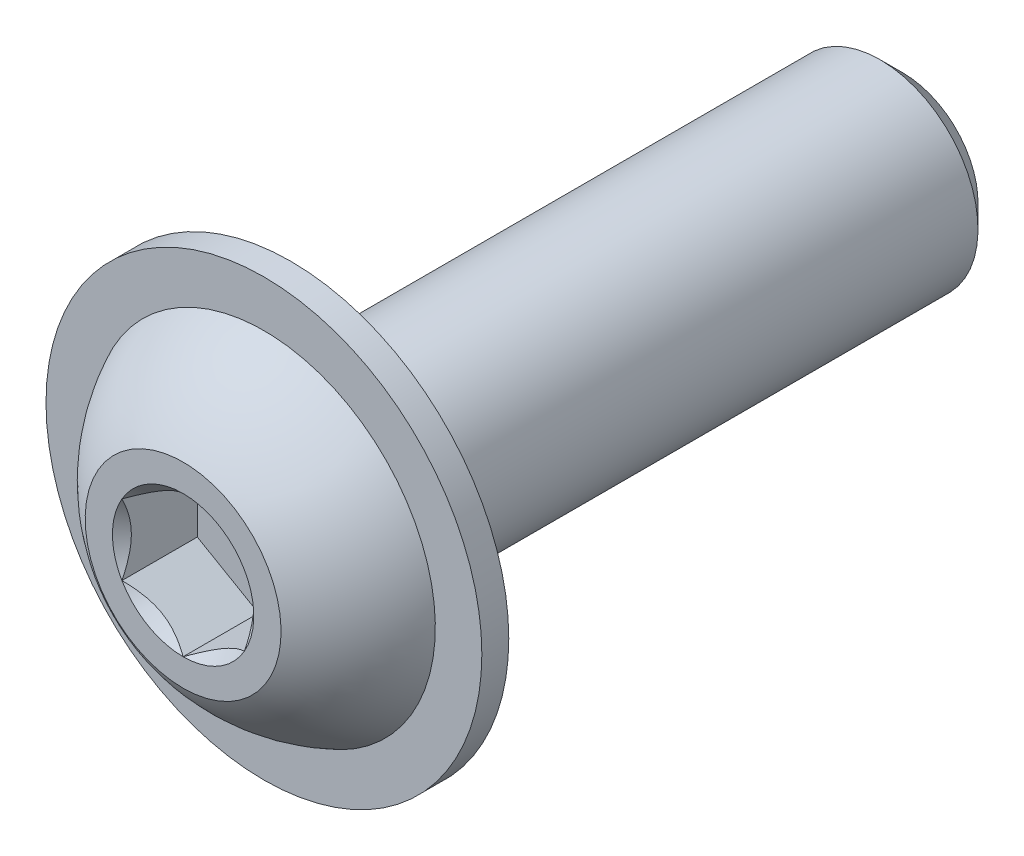
from build123d import *

# Parameters (mm, degrees)
SKETCH1_W           = 25
SKETCH1_H           = 4
CHAMFER1_SIZE       = 0.9375
SKETCH11_R          = 8.9
BOSS_EXTRUDE3_DEPTH = 1.1
CUT_EXTRUDE2_DEPTH  = 3.08


with BuildPart() as part:
    # Sketch1 → Revolve1 (revolve)
    with BuildSketch(Plane(origin=(0, 0, 0), x_dir=(0, 0, -1), z_dir=(1, 0, 0))):
        with Locations((16.9, 2)):
            Rectangle(SKETCH1_W, SKETCH1_H)
    revolve(axis=Axis((0, 0, -29.4), (0, 0, 1)))

    # Chamfer1
    chamfer1_edges = [part.edges().sort_by_distance(p)[0] for p in [
        (0, -4, -29.4),
    ]]
    chamfer(chamfer1_edges, length=CHAMFER1_SIZE)

    # Sketch7 → Revolve2 (revolve)
    with BuildSketch(Plane(origin=(0, 0, 0), x_dir=(0, 0, -1), z_dir=(1, 0, 0)), mode=Mode.PRIVATE) as revolve2_sk:
        with BuildLine():
            Line((3.3, 7), (4.4, 7))
            Line((4.4, 7), (4.4, 0))
            Line((4.4, 0), (0, 0))
            Line((0, 0), (0, 4))
            ThreePointArc((0, 4), (1.429846746, 5.74216858), (3.3, 7))
        make_face()
    revolve(revolve2_sk.sketch.rotate(Axis((0, 0, 0), (0, 0, -1)), 180), axis=Axis((0, 0, 0), (0, 0, -1)))

    # Sketch11 → Boss-Extrude3 (add)
    with BuildSketch(Plane(origin=(0, 0, -4.4), x_dir=(-1, 0, 0), z_dir=(0, 0, -1))):
        Circle(SKETCH11_R)
    extrude(amount=-BOSS_EXTRUDE3_DEPTH)

    # Sketch5 → Cut-Extrude2 (cut)
    with BuildSketch(Plane.XY):
        Polygon((2.5, -1.443375673), (2.5, 1.443375673), (0, 2.886751346), (-2.5, 1.443375673), (-2.5, -1.443375673), (0, -2.886751346), align=None)
    extrude(amount=-CUT_EXTRUDE2_DEPTH, mode=Mode.SUBTRACT)

    # Cut-Extrude3 cone 1 section (through the dimple's axis) → Cut-Extrude3 (revolve, cut)
    with BuildSketch(Plane(origin=(0, 0, 0), x_dir=(0, -1, 0), z_dir=(1, 0, 0))):
        Polygon((0, 0), (2.886751346, 0), (0, 2.886751346), align=None)
    revolve(axis=Axis((0, 0, 0), (0, 0, -1)), mode=Mode.SUBTRACT)


solid = part.part
